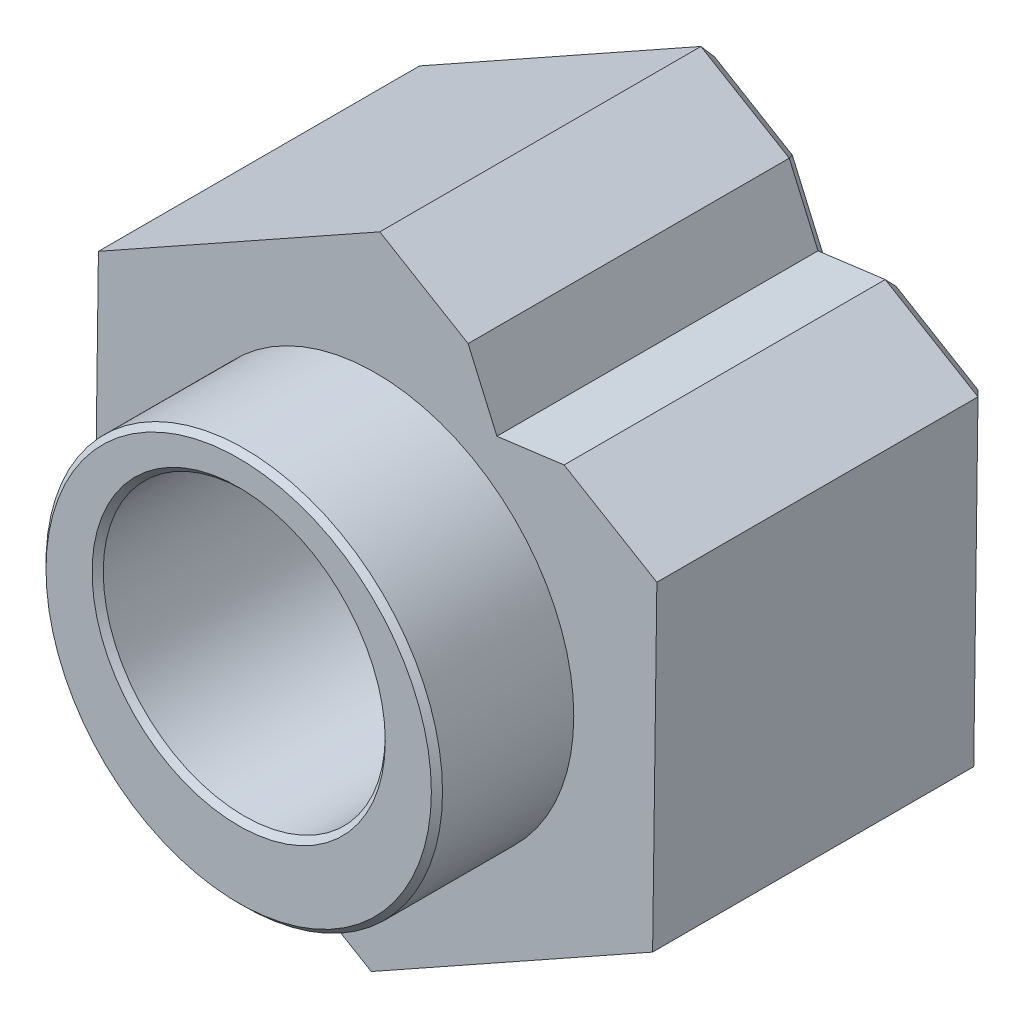
from build123d import *

# Parameters (mm, degrees)
RESSALTO_EXTRUS_O1_DEPTH = 6
ESBO_O2_R                = 3.55
RESSALTO_EXTRUS_O2_DEPTH = 2.45
CORTE_EXTRUS_O1_DEPTH    = 12.406502719
CORTE_EXTRUS_O2_REACH    = 13.407
ESBO_O4_R                = 2.525
CHANFRO2_SIZE            = 0.25
CHANFRO3_SIZE            = 0.1


with BuildPart() as part:
    # Esboço1 → Ressalto-extrusão1 (new body)
    with BuildSketch(Plane.XY):
        Polygon((4.961441577, -2.952529562), (5.037686394, 2.820469664), (0.076244817, 5.772999226), (-4.961441577, 2.952529562), (-5.037686394, -2.820469664), (-0.076244817, -5.772999226), align=None)
    extrude(amount=RESSALTO_EXTRUS_O1_DEPTH)

    # Esboço2 → Ressalto-extrusão2 (add)
    with BuildSketch(Plane.XY.offset(6)):
        Circle(ESBO_O2_R)
    extrude(amount=RESSALTO_EXTRUS_O2_DEPTH)

    # Esboço3 → Corte-extrusão1 (cut, through all)
    with BuildSketch(Plane(origin=(0, 0, 0), x_dir=(-1, 0, 0), z_dir=(0, 0, -1))):
        Polygon((-1.65800996, 4.831698543), (-2.173420765, 3.652224278), (-3.376703738, 3.808912301), align=None)
    extrude(amount=-CORTE_EXTRUS_O1_DEPTH, mode=Mode.SUBTRACT)

    # Esboço4 → Corte-extrusão2 (cut, up to next)
    with BuildSketch(Plane.XY.offset(8.45), mode=Mode.PRIVATE) as corte_extrus_o2_sk1:
        with Locations((0, 0.375)):
            Circle(ESBO_O4_R)
    corte_extrus_o2_tool1 = extrude(corte_extrus_o2_sk1.sketch, amount=-CORTE_EXTRUS_O2_REACH, mode=Mode.PRIVATE) & part.part
    add(corte_extrus_o2_tool1.solids().sort_by_distance((0, 0.375, 8.45))[0], mode=Mode.SUBTRACT)

    # Chanfro2
    chanfro2_edges = [part.edges().sort_by_distance(p)[0] for p in [
        (4.999563986, -0.066029949, 0),
        (2.44259838, -4.362764394, 0),
        (4.207195066, 3.314690983, 0),
        (-2.556965606, -4.296734445, 0),
        (-4.999563986, 0.066029949, 0),
        (-2.44259838, 4.362764394, 0),
        (2.775062251, 3.73056829, 0),
        (0.867127389, 5.302348884, 0),
        (1.915715362, 4.241961411, 0),
        (-2.525, 0.375, 0),
    ]]
    chamfer(chanfro2_edges, length=CHANFRO2_SIZE)

    # Chanfro3
    chanfro3_edges = [part.edges().sort_by_distance(p)[0] for p in [
        (-3.55, 0, 8.45),
        (-2.525, 0.375, 8.45),
    ]]
    chamfer(chanfro3_edges, length=CHANFRO3_SIZE)


solid = part.part
